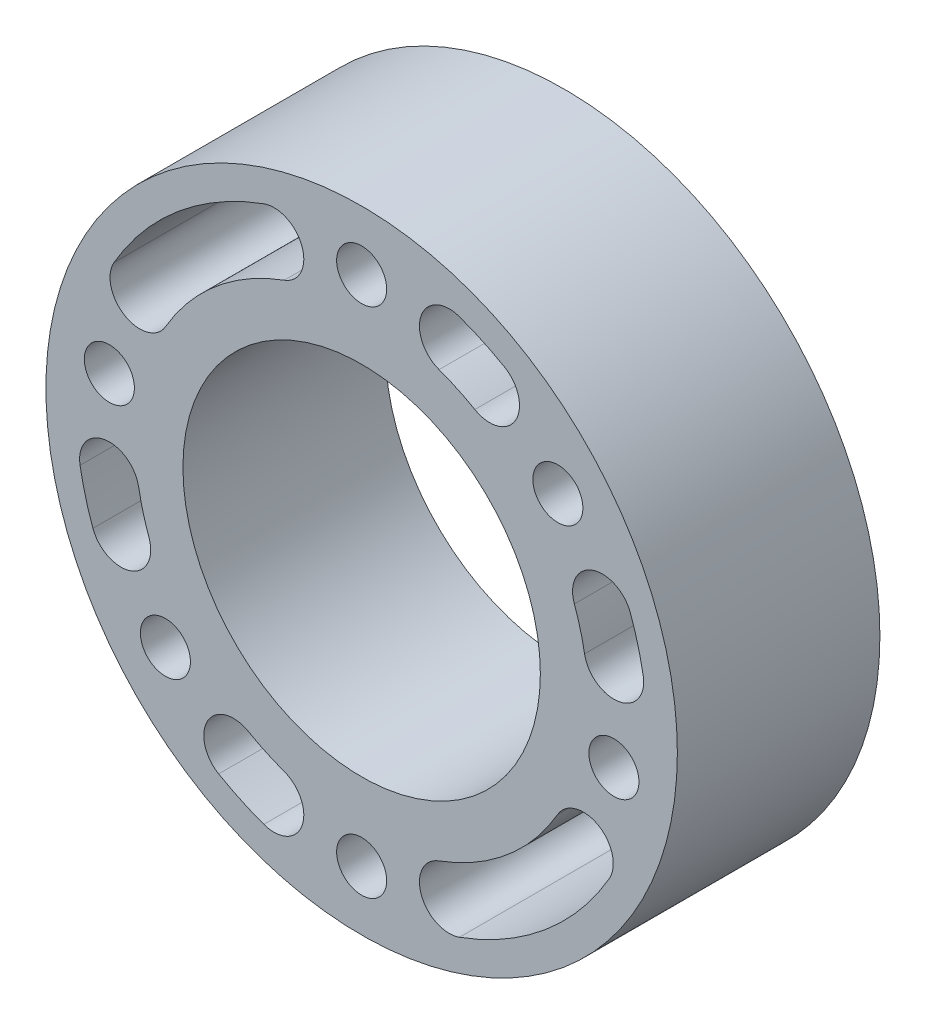
from build123d import *

# Parameters (mm, degrees)
SKETCH_1_R      = 26.5
SKETCH_1_R_2    = 15
SKETCH_1_R_3    = 2.1
EXTRUDE_1_DEPTH = 17


with BuildPart() as part:
    # 草图1 → 凸台-拉伸1 (new body)
    with BuildSketch(Plane.XY):
        Circle(SKETCH_1_R)
        Circle(SKETCH_1_R_2, mode=Mode.SUBTRACT)
        with Locations((0, 21.5)):
            Circle(SKETCH_1_R_3, mode=Mode.SUBTRACT)
        with Locations((16.469955527, 13.819933608)):
            Circle(SKETCH_1_R_3, mode=Mode.SUBTRACT)
        with Locations((21.17336669, -3.73343582)):
            Circle(SKETCH_1_R_3, mode=Mode.SUBTRACT)
        with Locations((0, -21.5)):
            Circle(SKETCH_1_R_3, mode=Mode.SUBTRACT)
        with Locations((-16.469955527, -13.819933608)):
            Circle(SKETCH_1_R_3, mode=Mode.SUBTRACT)
        with Locations((-21.17336669, 3.73343582)):
            Circle(SKETCH_1_R_3, mode=Mode.SUBTRACT)
        with BuildLine():
            ThreePointArc((-8.20848344, 22.552622899), (-15.426902632, 18.385066635), (-20.784609691, 12))
            ThreePointArc((-20.784609691, 12), (-19.869546181, 8.584936491), (-16.454482672, 9.5))
            ThreePointArc((-16.454482672, 9.5), (-12.212964584, 14.554844419), (-6.498382723, 17.854159795))
            ThreePointArc((-6.498382723, 17.854159795), (-5.00420153, 21.058441705), (-8.20848344, 22.552622899))
        make_face(mode=Mode.SUBTRACT)
        with BuildLine():
            ThreePointArc((12, 20.784609691), (10.142838282, 21.751386889), (8.20848344, 22.552622899))
            ThreePointArc((8.20848344, 22.552622899), (5.00420153, 21.058441705), (6.498382723, 17.854159795))
            ThreePointArc((6.498382723, 17.854159795), (8.029746973, 17.219847954), (9.5, 16.454482672))
            ThreePointArc((9.5, 16.454482672), (12.915063509, 17.369546181), (12, 20.784609691))
        make_face(mode=Mode.SUBTRACT)
        with BuildLine():
            ThreePointArc((18.711347307, 3.299315376), (18.352590699, 4.917561857), (17.854159795, 6.498382723))
            ThreePointArc((17.854159795, 6.498382723), (19.348340989, 9.702664633), (22.552622899, 8.20848344))
            ThreePointArc((22.552622899, 8.20848344), (23.182219831, 6.211657082), (23.635386072, 4.167556264))
            ThreePointArc((23.635386072, 4.167556264), (21.607487134, 1.271416437), (18.711347307, 3.299315376))
        make_face(mode=Mode.SUBTRACT)
        with BuildLine():
            ThreePointArc((6.498382723, -17.854159795), (12.212964584, -14.554844419), (16.454482672, -9.5))
            ThreePointArc((16.454482672, -9.5), (19.869546181, -8.584936491), (20.784609691, -12))
            ThreePointArc((20.784609691, -12), (15.426902632, -18.385066635), (8.20848344, -22.552622899))
            ThreePointArc((8.20848344, -22.552622899), (5.00420153, -21.058441705), (6.498382723, -17.854159795))
        make_face(mode=Mode.SUBTRACT)
        with BuildLine():
            ThreePointArc((-9.5, -16.454482672), (-8.029746973, -17.219847954), (-6.498382723, -17.854159795))
            ThreePointArc((-6.498382723, -17.854159795), (-5.00420153, -21.058441705), (-8.20848344, -22.552622899))
            ThreePointArc((-8.20848344, -22.552622899), (-10.142838282, -21.751386889), (-12, -20.784609691))
            ThreePointArc((-12, -20.784609691), (-12.915063509, -17.369546181), (-9.5, -16.454482672))
        make_face(mode=Mode.SUBTRACT)
        with BuildLine():
            ThreePointArc((-23.635386072, -4.167556264), (-23.182219831, -6.211657082), (-22.552622899, -8.20848344))
            ThreePointArc((-22.552622899, -8.20848344), (-19.348340989, -9.702664633), (-17.854159795, -6.498382723))
            ThreePointArc((-17.854159795, -6.498382723), (-18.352590699, -4.917561857), (-18.711347307, -3.299315376))
            ThreePointArc((-18.711347307, -3.299315376), (-21.607487134, -1.271416437), (-23.635386072, -4.167556264))
        make_face(mode=Mode.SUBTRACT)
    extrude(amount=EXTRUDE_1_DEPTH)


solid = part.part
